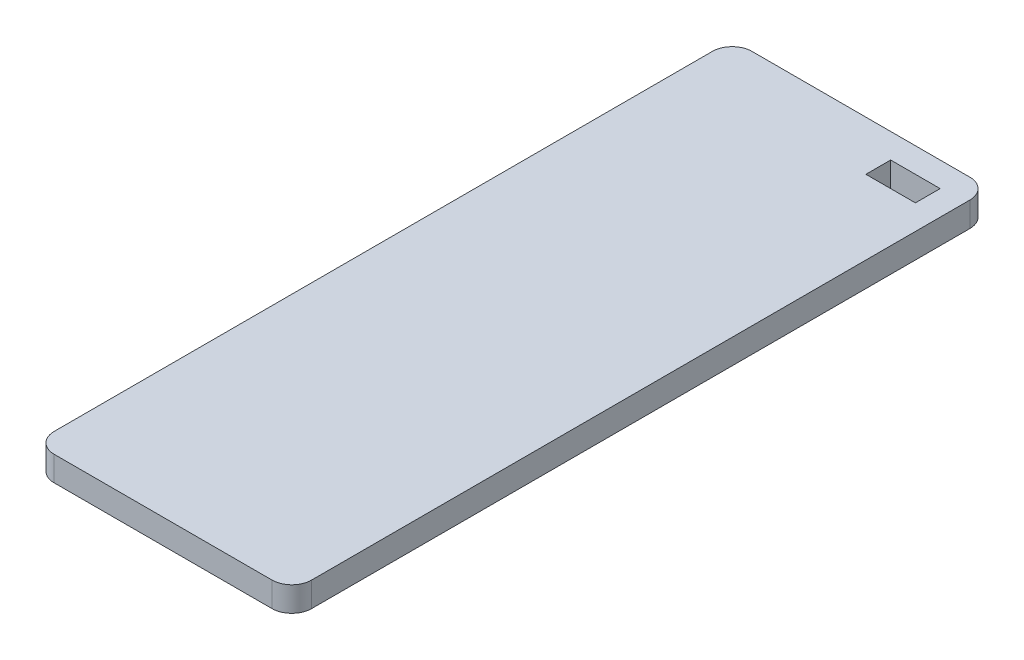
from build123d import *

# Parameters (mm, degrees)
SKETCH1_W           = 33.03
SKETCH1_H           = 89.525
BOSS_EXTRUDE1_DEPTH = 3.175
SKETCH2_W           = 6.35
SKETCH2_H           = 3.175
CUT_EXTRUDE1_DEPTH  = 63.137257853
FILLET1_R           = 2.54


with BuildPart() as part:
    # Sketch1 → Boss-Extrude1 (new body)
    with BuildSketch(Plane(origin=(0, 0, 0), x_dir=(1, 0, 0), z_dir=(0, 1, 0))):
        with Locations((-9.766081081, 11.453716216)):
            Rectangle(SKETCH1_W, SKETCH1_H)
    extrude(amount=BOSS_EXTRUDE1_DEPTH)

    # Sketch2 → Cut-Extrude1 (cut, through all)
    with BuildSketch(Plane(origin=(0, 3.175, 0), x_dir=(1, 0, 0), z_dir=(0, 1, 0))):
        with Locations((0.398918919, 51.453716216)):
            Rectangle(SKETCH2_W, SKETCH2_H)
    extrude(amount=-CUT_EXTRUDE1_DEPTH, mode=Mode.SUBTRACT)

    # Fillet1
    fillet1_edges = [part.edges().sort_by_distance(p)[0] for p in [
        (-26.281081081, 1.5875, -56.216216216),
        (6.748918919, 1.5875, -56.216216216),
        (6.748918919, 1.5875, 33.308783784),
        (-26.281081081, 1.5875, 33.308783784),
    ]]
    fillet(fillet1_edges, radius=FILLET1_R)


solid = part.part
